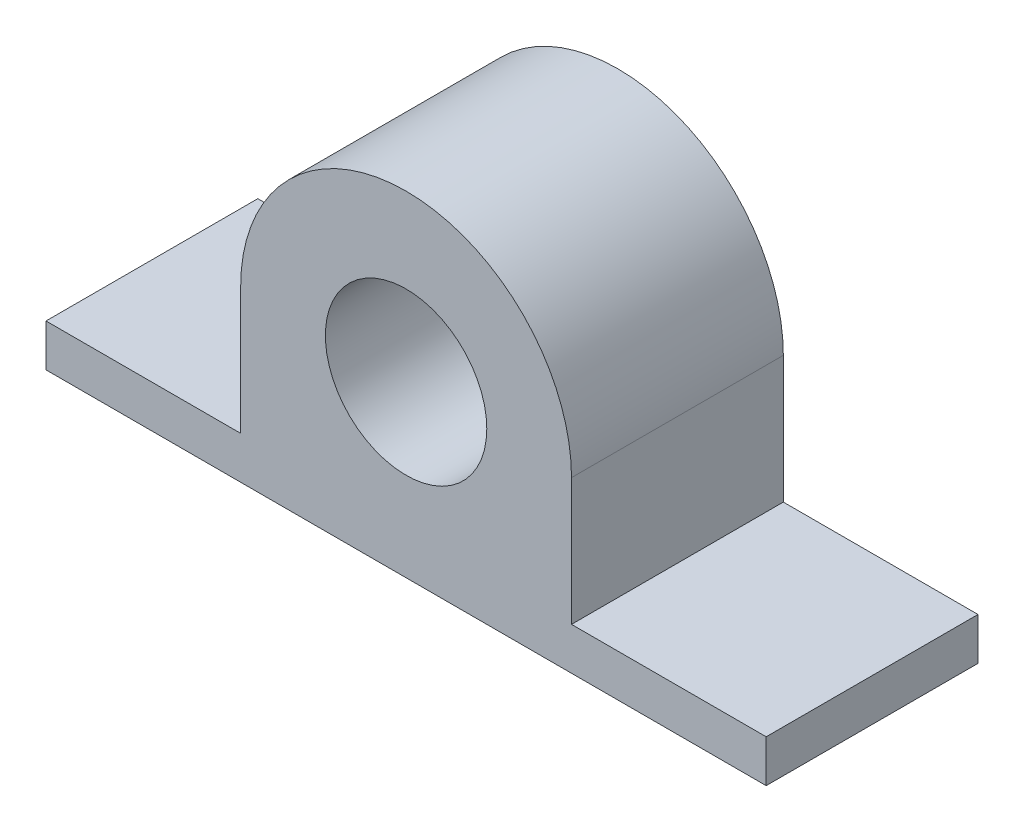
from build123d import *

# Parameters (mm, degrees)
SKETCH1_R           = 9.525
BOSS_EXTRUDE1_DEPTH = 12.5


with BuildPart() as part:
    # Sketch1 → Boss-Extrude1 (new, symmetric)
    with BuildSketch(Plane.XY):
        with BuildLine():
            Line((-19.525, 0), (-19.525, -15))
            Line((-19.525, -15), (-42.5, -15))
            Line((-42.5, -15), (-42.5, -20))
            Line((-42.5, -20), (42.5, -20))
            Line((42.5, -20), (42.5, -15))
            Line((42.5, -15), (19.525, -15))
            Line((19.525, -15), (19.525, 0))
            ThreePointArc((19.525, 0), (0, 19.525), (-19.525, 0))
        make_face()
        Circle(SKETCH1_R, mode=Mode.SUBTRACT)
    extrude(amount=BOSS_EXTRUDE1_DEPTH, both=True)


solid = part.part
